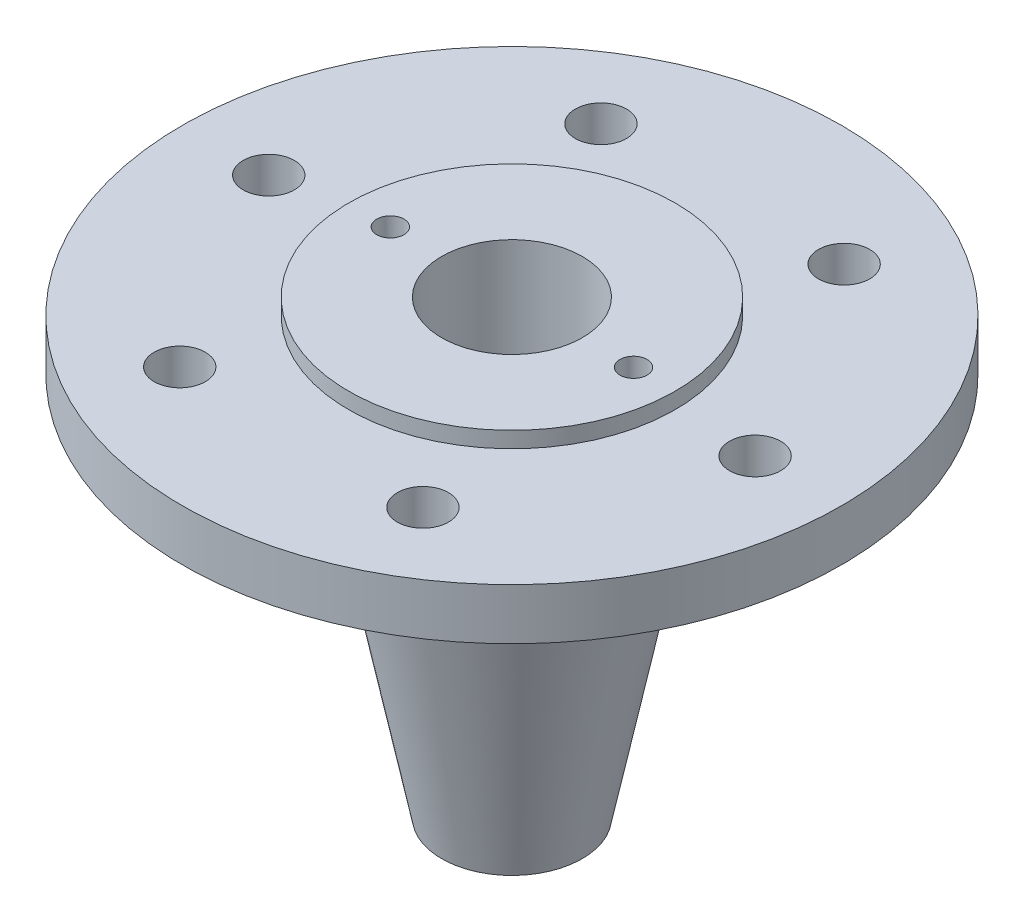
from build123d import *

# Parameters (mm, degrees)
SKETCH2_R          = 8
CUT_EXTRUDE1_DEPTH = 200.283717348
SKETCH3_R          = 4.25
CUT_EXTRUDE2_DEPTH = 18


with BuildPart() as part:
    # Sketch1 → Revolve1 (revolve)
    with BuildSketch(Plane.XY):
        Polygon((-22, 0), (-11, 0), (-11, 35.574468085), (-16, 38.334450356), (-16, 52.574533983), (-11, 55.574468085), (-11, 89.856516475), (-22, 97), (-22, 141), (-51, 141), (-51, 136), (-103, 136), (-103, 120), (-54, 120), (-54, 110), (-44, 110), align=None)
    revolve(axis=Axis((0, 0, 0), (0, 1, 0)))

    # Sketch2 → Cut-Extrude1 (cut, through all)
    with BuildSketch(Plane(origin=(0, 136, 0), x_dir=(1, 0, 0), z_dir=(0, 1, 0))):
        with Locations((-76, 0)):
            Circle(SKETCH2_R)
        with Locations((-38, 65.817930688)):
            Circle(SKETCH2_R)
        with Locations((38, 65.817930688)):
            Circle(SKETCH2_R)
        with Locations((76, 0)):
            Circle(SKETCH2_R)
        with Locations((38, -65.817930688)):
            Circle(SKETCH2_R)
        with Locations((-38, -65.817930688)):
            Circle(SKETCH2_R)
    extrude(amount=-CUT_EXTRUDE1_DEPTH, mode=Mode.SUBTRACT)

    # Sketch3 → Cut-Extrude2 (cut)
    with BuildSketch(Plane(origin=(0, 141, 0), x_dir=(1, 0, 0), z_dir=(0, 1, 0))):
        with Locations((-38, 0)):
            Circle(SKETCH3_R)
        with Locations((38, 0)):
            Circle(SKETCH3_R)
    extrude(amount=-CUT_EXTRUDE2_DEPTH, mode=Mode.SUBTRACT)


solid = part.part
